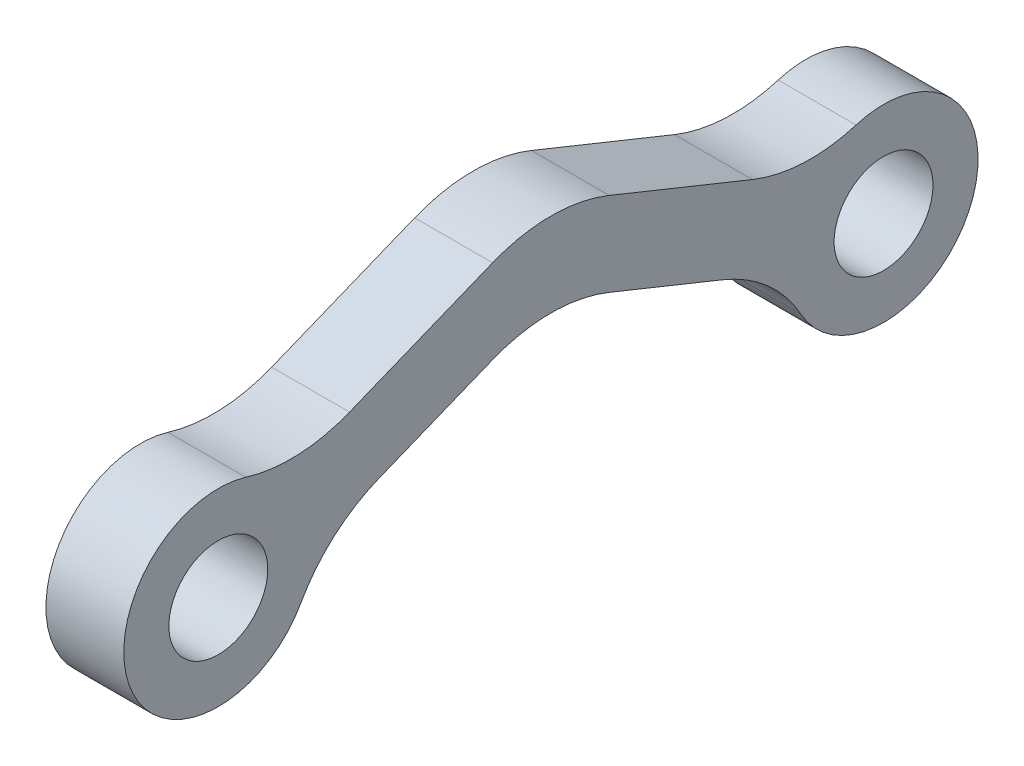
from build123d import *

# Parameters (mm, degrees)
SKETCH1_R           = 3.175
BOSS_EXTRUDE1_DEPTH = 5


with BuildPart() as part:
    # Sketch1 → Boss-Extrude1 (new body)
    with BuildSketch(Plane(origin=(0, 0, 0), x_dir=(0, 0, -1), z_dir=(1, 0, 0))):
        with BuildLine():
            Line((-34.292652671, 6.101206192), (-25.106065934, 9.812828159))
            ThreePointArc((-25.106065934, 9.812828159), (-21.36, 10.540989614), (-17.613934066, 9.812828159))
            Line((-17.613934066, 9.812828159), (-8.427347329, 6.101206192))
            ThreePointArc((-8.427347329, 6.101206192), (-5.123042901, 5.382807164), (-1.768225144, 5.806744341))
            ThreePointArc((-1.768225144, 5.806744341), (5.628005997, -2.273862022), (-5.305658284, -2.948709917))
            ThreePointArc((-5.305658284, -2.948709917), (-7.424420711, -0.313302797), (-10.300380296, 1.465286919))
            Line((-10.300380296, 1.465286919), (-17.613934066, 4.420154446))
            ThreePointArc((-17.613934066, 4.420154446), (-21.36, 5.1483159), (-25.106065934, 4.420154446))
            Line((-25.106065934, 4.420154446), (-32.419619704, 1.465286919))
            ThreePointArc((-32.419619704, 1.465286919), (-35.295579289, -0.313302797), (-37.414341716, -2.948709917))
            ThreePointArc((-37.414341716, -2.948709917), (-48.348005997, -2.273862022), (-40.951774856, 5.806744341))
            ThreePointArc((-40.951774856, 5.806744341), (-37.596957099, 5.382807164), (-34.292652671, 6.101206192))
        make_face()
        Circle(SKETCH1_R, mode=Mode.SUBTRACT)
        with Locations((-42.72, 0)):
            Circle(SKETCH1_R, mode=Mode.SUBTRACT)
    extrude(amount=BOSS_EXTRUDE1_DEPTH)


solid = part.part
